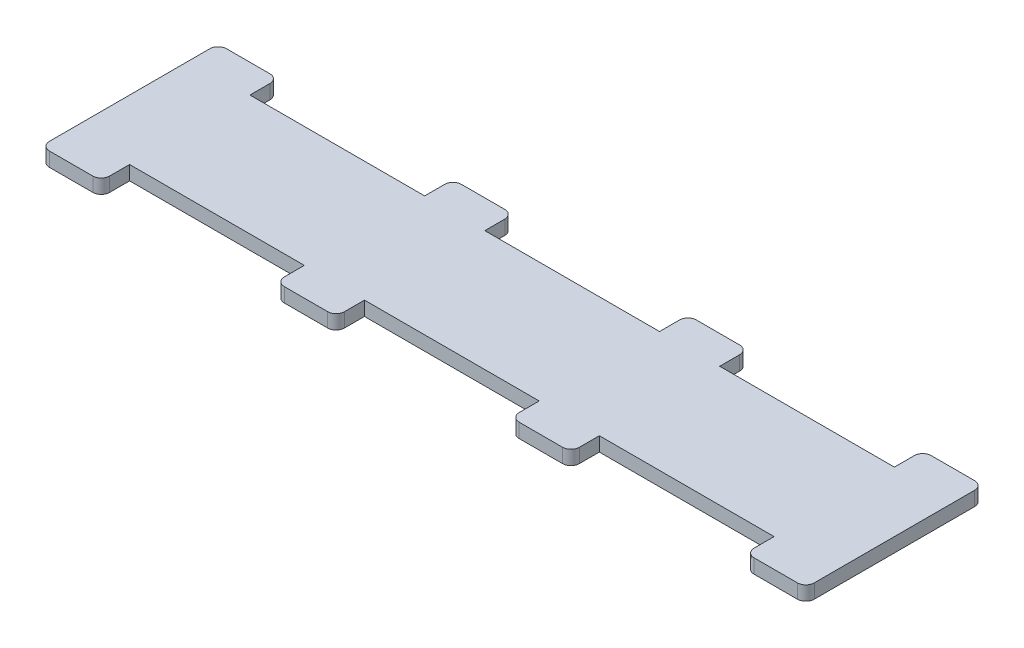
from build123d import *

# Parameters (mm, degrees)
SKETCH1_W            = 161.4424
SKETCH1_H            = 25.4
BOSS_EXTRUDE1_DEPTH  = 2.9972
SKETCH2_W            = 12.7
SKETCH2_H            = 5.9944
BOSS_EXTRUDE2_DEPTH  = 2.9972
FILLET1_R            = 1.778
FILLET1_OF_MIRROR1_R = 1.778


with BuildPart() as part:
    # Sketch1 → Boss-Extrude1 (new body)
    with BuildSketch(Plane(origin=(0, 0, 0), x_dir=(1, 0, 0), z_dir=(0, 1, 0))):
        Rectangle(SKETCH1_W, SKETCH1_H)
    extrude(amount=BOSS_EXTRUDE1_DEPTH)

    # Sketch2 → Boss-Extrude2 (add)
    with BuildSketch(Plane(origin=(0, 2.9972, 0), x_dir=(1, 0, 0), z_dir=(0, 1, 0))):
        with Locations((-74.3712, 15.6972)):
            Rectangle(SKETCH2_W, SKETCH2_H)
        with Locations((-24.7904, 15.6972)):
            Rectangle(SKETCH2_W, SKETCH2_H)
        with Locations((24.7904, 15.6972)):
            Rectangle(SKETCH2_W, SKETCH2_H)
        with Locations((74.3712, 15.6972)):
            Rectangle(SKETCH2_W, SKETCH2_H)
    boss_extrude2 = extrude(amount=-BOSS_EXTRUDE2_DEPTH)

    # Fillet1
    fillet1_edges = [part.edges().sort_by_distance(p)[0] for p in [
        (-68.0212, 1.4986, -18.6944),
        (-80.7212, 1.4986, -18.6944),
        (-18.4404, 1.4986, -18.6944),
        (-31.1404, 1.4986, -18.6944),
        (31.1404, 1.4986, -18.6944),
        (18.4404, 1.4986, -18.6944),
        (68.0212, 1.4986, -18.6944),
        (80.7212, 1.4986, -18.6944),
    ]]
    fillet(fillet1_edges, radius=FILLET1_R)

    # Mirror1: Boss-Extrude2 across plane
    add(boss_extrude2.mirror(Plane.XY))

    # Fillet1 of Mirror1
    fillet1_of_mirror1_edges = [part.edges().sort_by_distance(p)[0] for p in [
        (-68.0212, 1.4986, 18.6944),
        (-80.7212, 1.4986, 18.6944),
        (-18.4404, 1.4986, 18.6944),
        (-31.1404, 1.4986, 18.6944),
        (31.1404, 1.4986, 18.6944),
        (18.4404, 1.4986, 18.6944),
        (68.0212, 1.4986, 18.6944),
        (80.7212, 1.4986, 18.6944),
    ]]
    fillet(fillet1_of_mirror1_edges, radius=FILLET1_OF_MIRROR1_R)


solid = part.part
